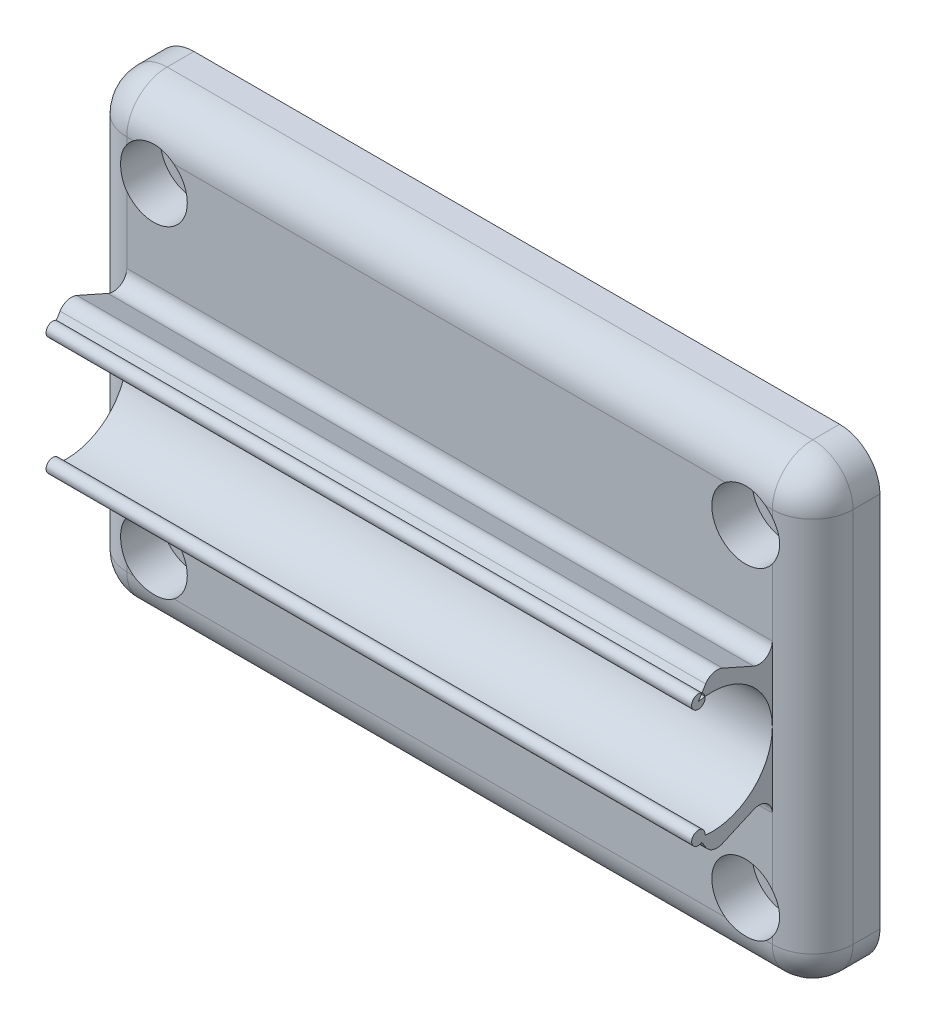
from build123d import *

# Parameters (mm, degrees)
SKETCH1_W                = 54
SKETCH1_H                = 34
SKETCH1_R                = 1
BOSS_EXTRUDE1_DEPTH      = 5
FILLET2_R                = 3
SKETCH2_R                = 2.5
CUT_EXTRUDE1_DEPTH       = 3
BOSS_EXTRUDE2_DEPTH      = 7
BOSS_EXTRUDE2_DEPTH_BACK = 41
FILLET3_R                = 1


with BuildPart() as part:
    # Sketch1 → Boss-Extrude1 (new body)
    with BuildSketch(Plane.XY):
        with Locations((27, -17)):
            Rectangle(SKETCH1_W, SKETCH1_H)
        with Locations((5, -5)):
            Circle(SKETCH1_R, mode=Mode.SUBTRACT)
        with Locations((49, -5)):
            Circle(SKETCH1_R, mode=Mode.SUBTRACT)
        with Locations((49, -29)):
            Circle(SKETCH1_R, mode=Mode.SUBTRACT)
        with Locations((5, -29)):
            Circle(SKETCH1_R, mode=Mode.SUBTRACT)
    extrude(amount=BOSS_EXTRUDE1_DEPTH)

    # Fillet2
    fillet2_edges = [part.edges().sort_by_distance(p)[0] for p in [
        (54, -17, 5),
        (27, 0, 5),
        (0, -17, 5),
        (0, 0, 2.5),
        (54, 0, 2.5),
        (54, -34, 2.5),
        (0, -34, 2.5),
        (27, -34, 5),
    ]]
    fillet(fillet2_edges, radius=FILLET2_R)

    # Sketch2 → Cut-Extrude1 (cut)
    with BuildSketch(Plane.XY.offset(5)):
        with Locations((5, -5)):
            Circle(SKETCH2_R)
        with Locations((5, -29)):
            Circle(SKETCH2_R)
        with Locations((49, -29)):
            Circle(SKETCH2_R)
        with Locations((49, -5)):
            Circle(SKETCH2_R)
    extrude(amount=-CUT_EXTRUDE1_DEPTH, mode=Mode.SUBTRACT)

    # Sketch4 → Boss-Extrude2 (add, two sides: drawn at the far end of the back side and taken through both)
    with BuildSketch(Plane(origin=(44, 0, 0), x_dir=(0, 0, -1), z_dir=(1, 0, 0)).offset(-BOSS_EXTRUDE2_DEPTH_BACK)):
        with BuildLine():
            ThreePointArc((-10.007082032, -21.471338481), (-10.914884898, -21.108429294), (-10.236484682, -21.812405336))
            Line((-10.236484682, -21.812405336), (-9.5, -23))
            Line((-9.5, -23), (-5, -21))
            Line((-5, -21), (-5, -17))
            ThreePointArc((-5, -17), (-6.502656939, -20.356476512), (-10.007082032, -21.471338481))
        make_face()
        with BuildLine():
            ThreePointArc((-10.007082032, -12.528661519), (-6.502656939, -13.643523488), (-5, -17))
            Line((-5, -17), (-5, -13))
            Line((-5, -13), (-9.5, -11))
            Line((-9.5, -11), (-10.236484682, -12.187594664))
            ThreePointArc((-10.236484682, -12.187594664), (-10.085115102, -12.333464906), (-10.007082032, -12.528661519))
        make_face()
        with BuildLine():
            ThreePointArc((-10.236484682, -12.187594664), (-10.914884898, -12.891570706), (-10.007082032, -12.528661519))
            ThreePointArc((-10.007082032, -12.528661519), (-10.254706587, -12.563738289), (-10.5, -12.612517806))
            Line((-10.5, -12.612517806), (-10.236484682, -12.187594664))
        make_face()
    extrude(amount=BOSS_EXTRUDE2_DEPTH + BOSS_EXTRUDE2_DEPTH_BACK)


with BuildPart() as boss_extrude2_piece_1:
    # of the separate pieces the step leaves, piece 1, a body of its own (boss_extrude2_pieces)
    add(part.part.solids().sort_by_distance((3, 0, 0))[0])

    # Fillet3
    fillet3_edges = [boss_extrude2_piece_1.edges().sort_by_distance(p)[0] for p in [
        (27, -11, 9.5),
        (27, -13, 5),
        (27, -23, 9.5),
        (27, -21, 5),
    ]]
    fillet(fillet3_edges, radius=FILLET3_R)


with BuildPart() as boss_extrude2_piece_2:
    # of the separate pieces the step leaves, piece 2, a body of its own (boss_extrude2_pieces)
    add(part.part.solids().sort_by_distance((3, -12.612517806, 10.5))[0])


solid = Compound([boss_extrude2_piece_1.part, boss_extrude2_piece_2.part])
